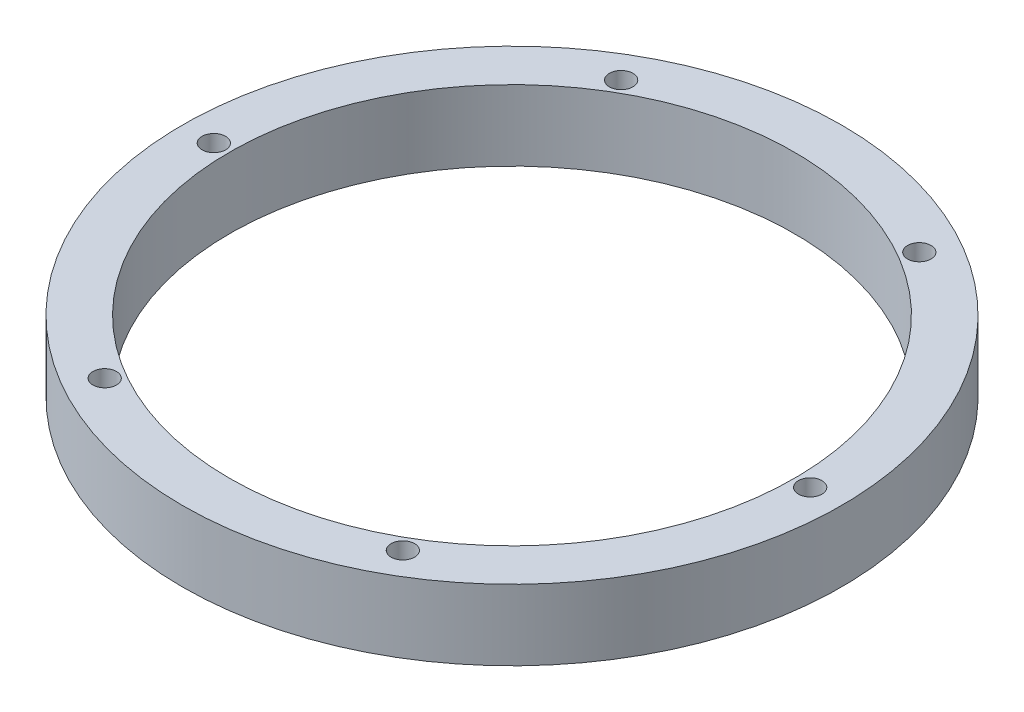
from build123d import *

# Parameters (mm, degrees)
SKETCH1_R           = 42
SKETCH1_R_2         = 36
SKETCH1_R_3         = 1.5
BOSS_EXTRUDE1_DEPTH = 9


with BuildPart() as part:
    # Sketch1 → Boss-Extrude1 (new body)
    with BuildSketch(Plane(origin=(0, 0, 0), x_dir=(1, 0, 0), z_dir=(0, 1, 0))):
        with Locations(Location((0, 0, 0), (0, 0, 270))):
            Circle(SKETCH1_R)
        with Locations(Location((0, 0, 0), (0, 0, 270))):
            Circle(SKETCH1_R_2, mode=Mode.SUBTRACT)
        with Locations(Location((19, -32.908965344, 0), (0, 0, 270))):
            Circle(SKETCH1_R_3, mode=Mode.SUBTRACT)
        with Locations(Location((-19, -32.908965344, 0), (0, 0, 270))):
            Circle(SKETCH1_R_3, mode=Mode.SUBTRACT)
        with Locations(Location((-38, 0, 0), (0, 0, 270))):
            Circle(SKETCH1_R_3, mode=Mode.SUBTRACT)
        with Locations(Location((-19, 32.908965344, 0), (0, 0, 270))):
            Circle(SKETCH1_R_3, mode=Mode.SUBTRACT)
        with Locations(Location((19, 32.908965344, 0), (0, 0, 270))):
            Circle(SKETCH1_R_3, mode=Mode.SUBTRACT)
        with Locations(Location((38, 0, 0), (0, 0, 270))):
            Circle(SKETCH1_R_3, mode=Mode.SUBTRACT)
    extrude(amount=BOSS_EXTRUDE1_DEPTH)


solid = part.part
